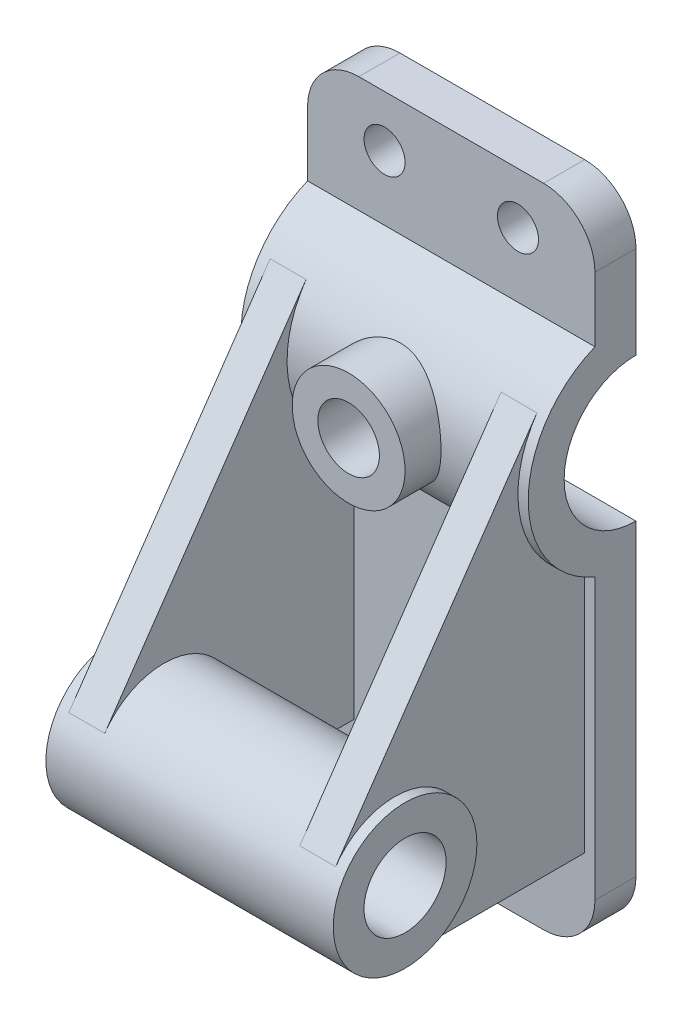
from build123d import *

# Parameters (mm, degrees)
BOSS_EXTRUDE1_DEPTH      = 28
FILLET1_R                = 10
SKETCH2_R                = 14
SKETCH2_R_2              = 8
BOSS_EXTRUDE3_DEPTH      = 28
BOSS_EXTRUDE4_START      = 7
BOSS_EXTRUDE4_DEPTH      = 7
BOSS_EXTRUDE5_REACH      = 95.814
BOSS_EXTRUDE5_END_RADIUS = 21
SKETCH5_R                = 11
SKETCH5_R_2              = 6
CUT_EXTRUDE1_DEPTH       = 94.813645093
CUT_EXTRUDE1_DEPTH_BACK  = 94.813645093
SKETCH6_R                = 6
CUT_EXTRUDE2_DEPTH       = 103.181211608
CUT_EXTRUDE2_DEPTH_BACK  = 103.181211608
SKETCH8_R                = 4
CUT_EXTRUDE3_DEPTH       = 103.181211608
CUT_EXTRUDE3_DEPTH_BACK  = 103.181211608
SKETCH9_R                = 4


with BuildPart() as part:
    # Sketch1 → Boss-Extrude1 (new, symmetric)
    with BuildSketch(Plane.YZ):
        with BuildLine():
            Line((42, 0), (14, 0))
            ThreePointArc((14, 0), (0, 14), (-14, 0))
            Line((-14, 0), (-84, 0))
            Line((-84, 0), (-84, 8))
            Line((-84, 8), (-19.416487839, 8))
            ThreePointArc((-19.416487839, 8), (0, 21), (19.416487839, 8))
            Line((19.416487839, 8), (42, 8))
            Line((42, 8), (42, 0))
        make_face()
    extrude(amount=BOSS_EXTRUDE1_DEPTH, both=True)

    # Fillet1
    fillet1_edges = [part.edges().sort_by_distance(p)[0] for p in [
        (-28, 42, 4),
        (28, -84, 4),
        (28, 42, 4),
        (-28, -84, 4),
    ]]
    fillet(fillet1_edges, radius=FILLET1_R)



with BuildPart() as body_2:
    # Sketch2 → Boss-Extrude3 (new, symmetric)
    with BuildSketch(Plane.YZ):
        with Locations(Location((-53, 45, 0), (0, 0, 270))):
            Circle(SKETCH2_R)
        with Locations(Location((-53, 45, 0), (0, 0, 270))):
            Circle(SKETCH2_R_2, mode=Mode.SUBTRACT)
    extrude(amount=BOSS_EXTRUDE3_DEPTH, both=True)


with BuildPart() as part_1:
    add(part.part)

    add(body_2.part)  # Boss-Extrude4 merges body 2
    # Sketch3 → Boss-Extrude4 (add)
    with BuildSketch(Plane.YZ.offset(19).offset(BOSS_EXTRUDE4_START)):
        with BuildLine():
            ThreePointArc((-39, 45), (-53, 31), (-67, 45))
            Line((-67, 45), (-67, 8))
            Line((-67, 8), (-19.416487839, 8))
            ThreePointArc((-19.416487839, 8), (-5.973550046, 20.132478731), (11.911075968, 17.295267251))
            Line((11.911075968, 17.295267251), (-45.059282688, 56.530178167))
            ThreePointArc((-45.059282688, 56.530178167), (-40.607057606, 51.512678314), (-39, 45))
        make_face()
    boss_extrude4 = extrude(amount=-BOSS_EXTRUDE4_DEPTH)

    # Mirror1: Boss-Extrude4 across plane
    add(boss_extrude4.mirror(Plane(origin=(0, 0, 0), x_dir=(0, 0, 1), z_dir=(1, 0, 0))))

    # Boss-Extrude5: up to this cylinder (the profile starts outside it)
    boss_extrude5_end = Plane(origin=(-10.688873, 0, 0), z_dir=(-1, 0, 0)) * Cylinder(BOSS_EXTRUDE5_END_RADIUS, 234.628, mode=Mode.PRIVATE)
    # Sketch5 → Boss-Extrude5 (add, up to the surface)
    with BuildSketch(Plane.XY.offset(28), mode=Mode.PRIVATE) as boss_extrude5_sk1:
        Circle(SKETCH5_R)
        Circle(SKETCH5_R_2, mode=Mode.SUBTRACT)
    boss_extrude5_tool1 = extrude(boss_extrude5_sk1.sketch, amount=-BOSS_EXTRUDE5_REACH, mode=Mode.PRIVATE) - boss_extrude5_end
    add(boss_extrude5_tool1.solids().sort_by_distance((-10.688873, 0, 28))[0])

    # Sketch6 → Cut-Extrude1 (cut, two sides: drawn at the far end of the back side and taken through both)
    with BuildSketch(Plane.XY.offset(28).offset(-CUT_EXTRUDE1_DEPTH_BACK)):
        Circle(SKETCH6_R)
    extrude(amount=CUT_EXTRUDE1_DEPTH + CUT_EXTRUDE1_DEPTH_BACK, mode=Mode.SUBTRACT)

    # Sketch8 → Cut-Extrude2 (cut, two sides: drawn at the far end of the back side and taken through both)
    with BuildSketch(Plane.XY.offset(8).offset(-CUT_EXTRUDE2_DEPTH_BACK)):
        with Locations((-13, 32)):
            Circle(SKETCH8_R)
        with Locations((13, 32)):
            Circle(SKETCH8_R)
    extrude(amount=CUT_EXTRUDE2_DEPTH + CUT_EXTRUDE2_DEPTH_BACK, mode=Mode.SUBTRACT)

    # Sketch9 → Cut-Extrude3 (cut, two sides: drawn at the far end of the back side and taken through both)
    with BuildSketch(Plane.XY.offset(8).offset(-CUT_EXTRUDE3_DEPTH_BACK)):
        with Locations((-13, -74)):
            Circle(SKETCH9_R)
        with Locations((13, -74)):
            Circle(SKETCH9_R)
    extrude(amount=CUT_EXTRUDE3_DEPTH + CUT_EXTRUDE3_DEPTH_BACK, mode=Mode.SUBTRACT)


solid = part_1.part
